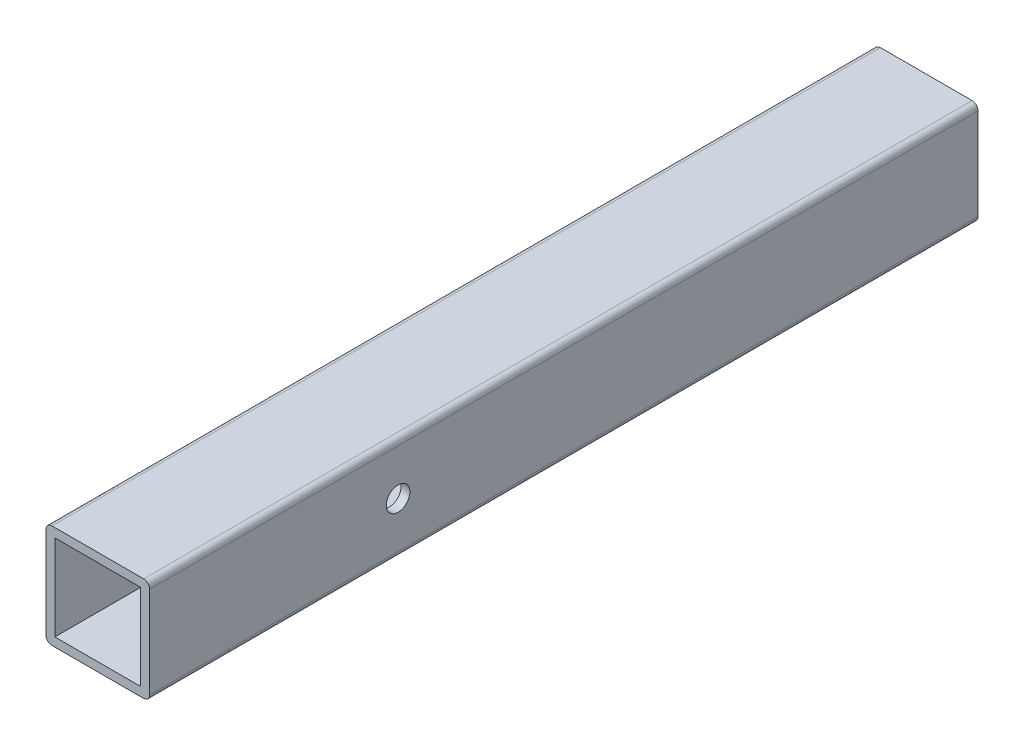
from build123d import *

# Parameters (mm, degrees)
EXTRUDE_THIN1_DEPTH      = 140
EXTRUDE_THIN1_DEPTH_BACK = 140
SKETCH1_W                = 35
SKETCH1_H                = 35
SKETCH1_W_2              = 29
SKETCH1_H_2              = 29
FILLET1_R                = 2
SKETCH2_R                = 4
CUT_EXTRUDE1_DEPTH       = 40


with BuildPart() as part:
    # Sketch1 → Extrude-Thin1 (new, two sides: drawn at the far end of the back side and taken through both)
    with BuildSketch(Plane.XY.offset(-EXTRUDE_THIN1_DEPTH_BACK)):
        Rectangle(SKETCH1_W, SKETCH1_H)
        Rectangle(SKETCH1_W_2, SKETCH1_H_2, mode=Mode.SUBTRACT)
    extrude(amount=EXTRUDE_THIN1_DEPTH + EXTRUDE_THIN1_DEPTH_BACK)

    # Fillet1
    fillet1_edges = [part.edges().sort_by_distance(p)[0] for p in [
        (17.5, -17.5, 0),
        (-17.5, -17.5, 0),
        (-17.5, 17.5, 0),
        (17.5, 17.5, 0),
    ]]
    fillet(fillet1_edges, radius=FILLET1_R)

    # Sketch2 → Cut-Extrude1 (cut)
    with BuildSketch(Plane(origin=(17.5, 0, 0), x_dir=(0, 0, -1), z_dir=(1, 0, 0))):
        with Locations(Location((-56, 0, 0), (0, 0, 180))):
            Circle(SKETCH2_R)
    extrude(amount=-CUT_EXTRUDE1_DEPTH, mode=Mode.SUBTRACT)


solid = part.part
